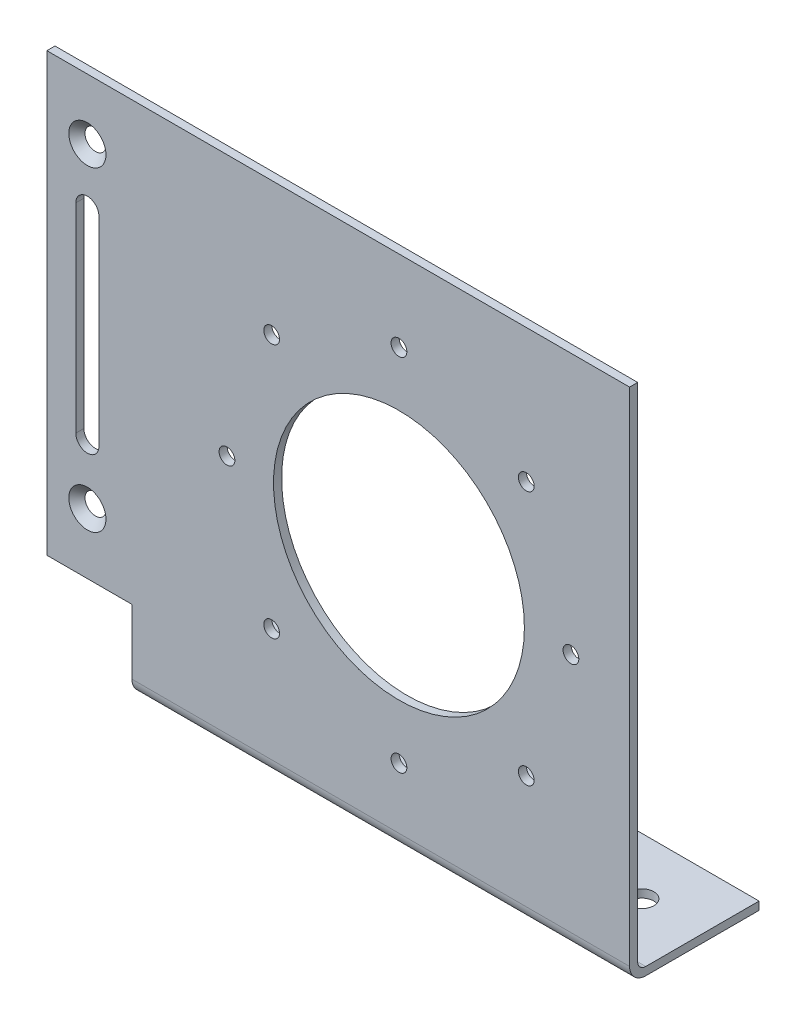
from build123d import *

# Parameters (mm, degrees)
AUFSATZ_LINEAR_AUSTRAGEN1_DEPTH                      = 2
SKIZZE2_W                                            = 123
SKIZZE2_H                                            = 2
AUFSATZ_LINEAR_AUSTRAGEN2_DEPTH                      = 30
VERRUNDUNG1_R                                        = 2
VERRUNDUNG2_R                                        = 4
SKIZZE3_R                                            = 3
SCHNITT_LINEAR_AUSTRAGEN1_DEPTH                      = 152.345576266
FORMSENKUNG_F_R_M4_SENKSCHRAUBE_MIT_INNE_D           = 4.5
FORMSENKUNG_F_R_M4_SENKSCHRAUBE_MIT_INNE_DEPTH       = 11.94
FORMSENKUNG_F_R_M4_SENKSCHRAUBE_MIT_INNE_CSINK_D     = 9.18
FORMSENKUNG_F_R_M4_SENKSCHRAUBE_MIT_INNE_CSINK_ANGLE = 90
FORMSENKUNG_F_R_M4_SENKSCHRAUBE_MIT_INNE_TIP         = 1.351936393
SKIZZE7_R                                            = 1.95
SKIZZE7_R_2                                          = 31
SCHNITT_LINEAR_AUSTRAGEN2_DEPTH                      = 106.295533596


with BuildPart() as part:
    # Skizze1 → Aufsatz-Linear austragen1 (new body)
    with BuildSketch(Plane.XY):
        Polygon((-69.023447297, -46.645824625), (-48.023447297, -46.645824625), (-48.023447297, -66.645824625), (74.976552703, -66.645824625), (74.976552703, 61.354175375), (-69.023447297, 61.354175375), align=None)
    extrude(amount=AUFSATZ_LINEAR_AUSTRAGEN1_DEPTH)

    # Skizze2 → Aufsatz-Linear austragen2 (add)
    with BuildSketch(Plane(origin=(0, 0, 0), x_dir=(-1, 0, 0), z_dir=(0, 0, -1))):
        with Locations((-13.476552703, -65.645824625)):
            Rectangle(SKIZZE2_W, SKIZZE2_H)
    extrude(amount=AUFSATZ_LINEAR_AUSTRAGEN2_DEPTH)

    # Verrundung1
    verrundung1_edges = [part.edges().sort_by_distance(p)[0] for p in [
        (13.476552703, -64.645824625, 0),
    ]]
    fillet(verrundung1_edges, radius=VERRUNDUNG1_R)

    # Verrundung2
    verrundung2_edges = [part.edges().sort_by_distance(p)[0] for p in [
        (13.476552703, -66.645824625, 2),
    ]]
    fillet(verrundung2_edges, radius=VERRUNDUNG2_R)

    # Skizze3 → Schnitt-Linear austragen1 (cut, through all)
    with BuildSketch(Plane.XZ.offset(66.645824625)):
        with Locations((-33.023447297, -16)):
            Circle(SKIZZE3_R)
        with Locations((59.976552703, -16)):
            Circle(SKIZZE3_R)
    extrude(amount=-SCHNITT_LINEAR_AUSTRAGEN1_DEPTH, mode=Mode.SUBTRACT)

    # Formsenkung für M4 Senkschraube mit Innensechskant1
    with Locations(Plane.XY.offset(2)):
        with Locations((-59.023447297, -31.645824625), (-59.023447297, 46.354175375)):
            CounterSinkHole(FORMSENKUNG_F_R_M4_SENKSCHRAUBE_MIT_INNE_D / 2, FORMSENKUNG_F_R_M4_SENKSCHRAUBE_MIT_INNE_CSINK_D / 2, depth=FORMSENKUNG_F_R_M4_SENKSCHRAUBE_MIT_INNE_DEPTH, counter_sink_angle=FORMSENKUNG_F_R_M4_SENKSCHRAUBE_MIT_INNE_CSINK_ANGLE)
            with Locations((0, 0, -(FORMSENKUNG_F_R_M4_SENKSCHRAUBE_MIT_INNE_DEPTH + FORMSENKUNG_F_R_M4_SENKSCHRAUBE_MIT_INNE_TIP / 2))):  # 118° drill point
                Cone(0, FORMSENKUNG_F_R_M4_SENKSCHRAUBE_MIT_INNE_D / 2, FORMSENKUNG_F_R_M4_SENKSCHRAUBE_MIT_INNE_TIP, mode=Mode.SUBTRACT)

    # Skizze7 → Schnitt-Linear austragen2 (cut, through all)
    with BuildSketch(Plane.XY.offset(2)):
        with Locations((17.976552703, 41.354175375)):
            Circle(SKIZZE7_R)
        with Locations((49.442804466, 28.320427137)):
            Circle(SKIZZE7_R)
        with Locations((49.442804466, -34.612076388)):
            Circle(SKIZZE7_R)
        with Locations((17.976552703, -47.645824625)):
            Circle(SKIZZE7_R)
        with Locations((-13.489699059, -34.612076388)):
            Circle(SKIZZE7_R)
        with Locations((-13.489699059, 28.320427137)):
            Circle(SKIZZE7_R)
        with Locations((17.976552703, -3.145824625)):
            Circle(SKIZZE7_R_2)
        with Locations((-24.523447297, -3.145824625)):
            Circle(SKIZZE7_R)
        with Locations((60.476552703, -3.145824625)):
            Circle(SKIZZE7_R)
        with BuildLine():
            Line((-61.881657041, -16.935182234), (-61.881657041, 32.354175375))
            ThreePointArc((-61.881657041, 32.354175375), (-59.023447297, 35.212385119), (-56.165237552, 32.354175375))
            Line((-56.165237552, 32.354175375), (-56.165237552, -16.935182234))
            ThreePointArc((-56.165237552, -16.935182234), (-59.023447297, -19.793391979), (-61.881657041, -16.935182234))
        make_face()
    extrude(amount=-SCHNITT_LINEAR_AUSTRAGEN2_DEPTH, mode=Mode.SUBTRACT)


solid = part.part
